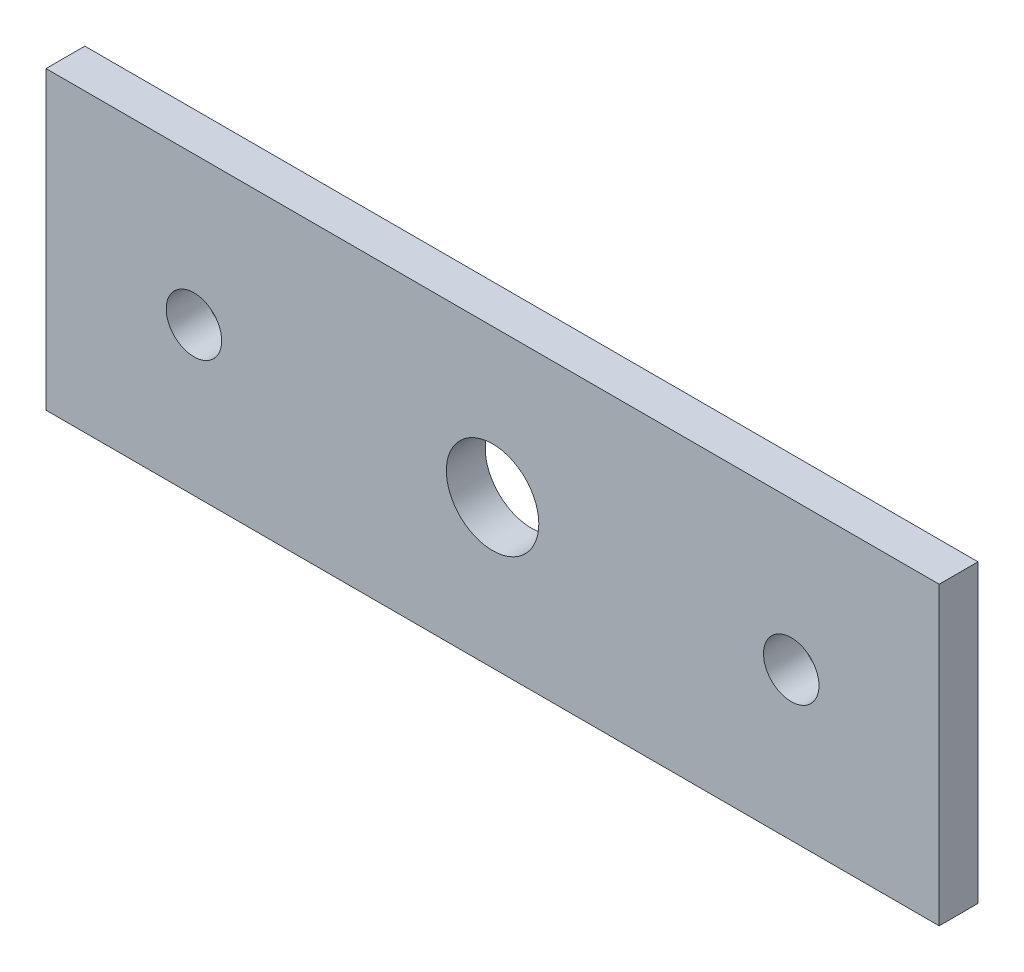
from build123d import *

# Parameters (mm, degrees)
SKETCH1_W           = 96.6
SKETCH1_H           = 32
BOSS_EXTRUDE1_DEPTH = 4.2
SKETCH2_R           = 3
SKETCH2_R_2         = 5
CUT_EXTRUDE1_DEPTH  = 79.620314942


with BuildPart() as part:
    # Sketch1 → Boss-Extrude1 (new body)
    with BuildSketch(Plane.XY):
        with Locations((28.417538555, 0.671328671)):
            Rectangle(SKETCH1_W, SKETCH1_H)
    extrude(amount=BOSS_EXTRUDE1_DEPTH)

    # Sketch2 → Cut-Extrude1 (cut, through all)
    with BuildSketch(Plane.XY.offset(4.2)):
        with Locations((-3.882461445, 0.671328671)):
            Circle(SKETCH2_R)
        with Locations((60.717538555, 0.671328671)):
            Circle(SKETCH2_R)
        with Locations((28.417538555, 0.671328671)):
            Circle(SKETCH2_R_2)
    extrude(amount=-CUT_EXTRUDE1_DEPTH, mode=Mode.SUBTRACT)


solid = part.part
